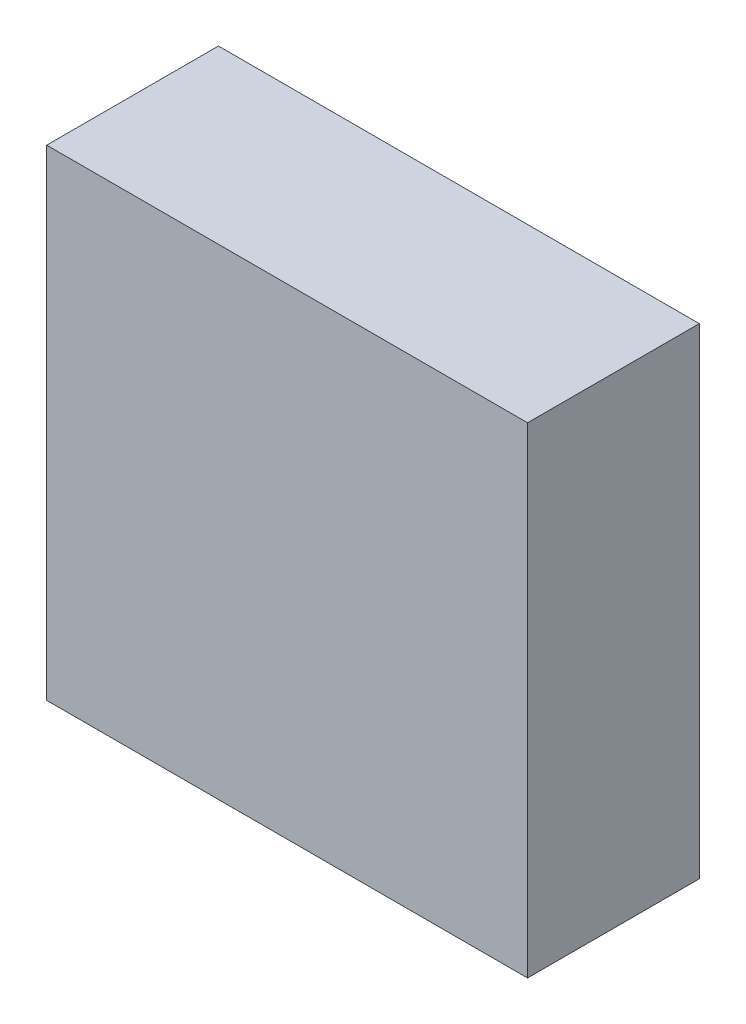
from build123d import *

# Parameters (mm, degrees)
SKETCH1_W           = 70
SKETCH1_H           = 70
BOSS_EXTRUDE1_DEPTH = 25


with BuildPart() as part:
    # Sketch1 → Boss-Extrude1 (new body)
    with BuildSketch(Plane.XY):
        Rectangle(SKETCH1_W, SKETCH1_H)
    extrude(amount=BOSS_EXTRUDE1_DEPTH)


solid = part.part
